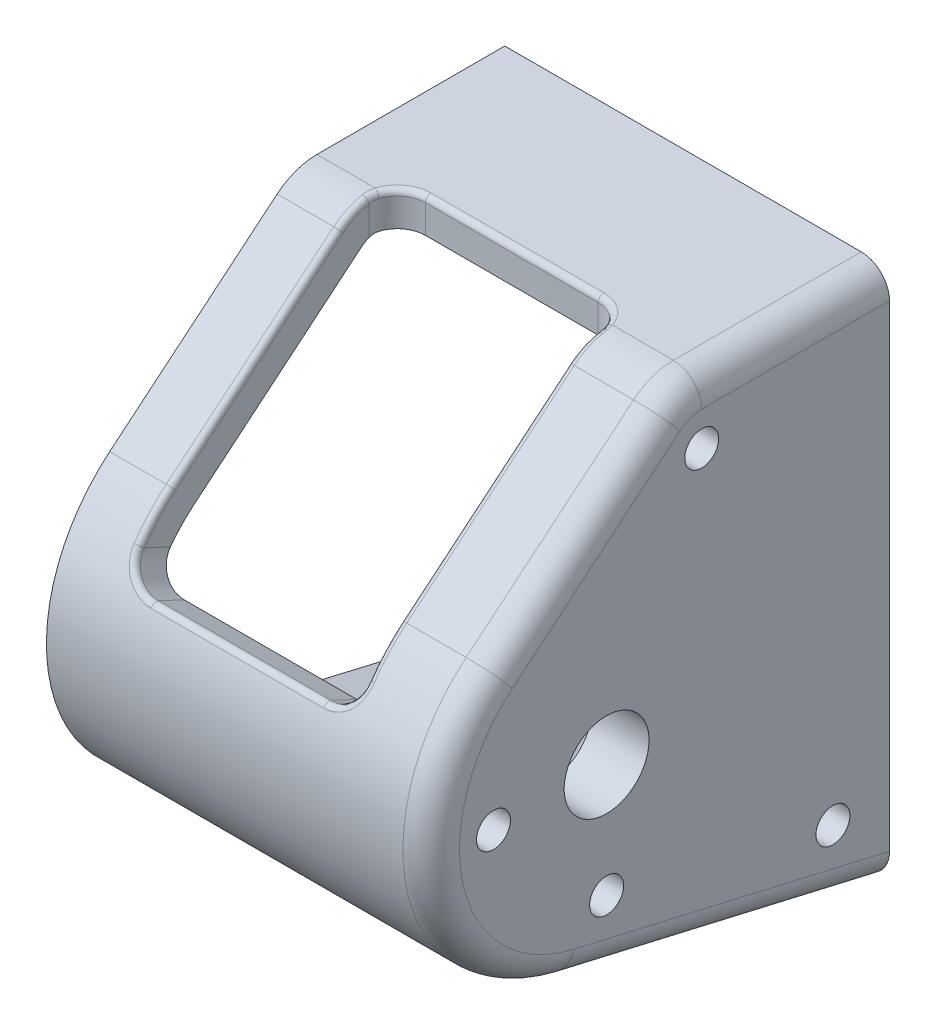
from build123d import *

# Parameters (mm, degrees)
BOSS_EXTRUDE1_DEPTH = 100
CUT_EXTRUDE1_DEPTH  = 126.95237195067031
FILLET1_R           = 5
BOSS_EXTRUDE2_START = 40.5
BOSS_EXTRUDE2_DEPTH = 40.5
FILLET2_R           = 11
FILLET3_R           = 5
BOSS_EXTRUDE4_DEPTH = 10
FILLET5_R           = 1
FILLET6_R           = 5
SKETCH8_R           = 7.5
CUT_EXTRUDE2_DEPTH  = 131.85870255202755
SKETCH9_R           = 1.2499999999993074
SKETCH9_R_2         = 1.2499999999993041
SKETCH9_R_3         = 1.2499999999993108
CUT_EXTRUDE3_DEPTH  = 131.85870255202755
SKETCH10_R          = 2.999999999999271
SKETCH10_R_2        = 2.9999999999993827
SKETCH10_R_3        = 2.9999999999993676
SKETCH10_R_4        = 2.9999999999984848
CUT_EXTRUDE4_DEPTH  = 5


with BuildPart() as part:
    # Sketch1 → Boss-Extrude1 (new body)
    with BuildSketch(Plane(origin=(0, 0, 0), x_dir=(1, 0, 0), z_dir=(0, 1, 0))):
        Polygon((-29.000000000000004, -50), (-29.000000000000004, 50), (28.999999999999996, 50.00000000000001), (28.999999999999996, -50), (22.5, -50), (22.49999999999999, 20.000000000000004), (-18.000000000000007, 20.000000000000004), (-18.000000000000007, -50), align=None)
    extrude(amount=BOSS_EXTRUDE1_DEPTH)

    # Sketch5 → Cut-Extrude1 (cut, through all)
    with BuildSketch(Plane(origin=(28.999999999999996, 0, 0), x_dir=(0, 0, -1), z_dir=(1, 0, 0))):
        with BuildLine():
            Line((50.00000000000001, 94), (15.000000000000007, 94))
            Line((15.000000000000007, 94), (-15.988977704079698, 68.21854812358211))
            ThreePointArc((-15.988977704079698, 68.21854812358211), (-24.331609312743236, 43.25780632057522), (-5.709440185764556, 24.660684217398867))
            Line((-5.709440185764556, 24.660684217398867), (44.000000000000014, 12.999999999999998))
            Line((44.000000000000014, 12.999999999999998), (50.00000000000001, 12.999999999999998))
            Line((50.00000000000001, 12.999999999999998), (50.00000000000001, 94))
        make_face()
        with BuildLine():
            Line((12.83046096501491, 100), (-19.82633235305885, 72.8309996732418))
            ThreePointArc((-19.82633235305885, 72.8309996732418), (-30.160384185664846, 41.83402304126666), (-6.988314668956372, 18.797956061093338))
            Line((-6.988314668956372, 18.797956061093338), (44, 6.999999999999997))
            Line((44, 6.999999999999997), (49.99999999999999, 6.999999999999992))
            Line((49.99999999999999, 6.999999999999992), (49.99999999999999, 0))
            Line((49.99999999999999, 0), (-50.00000000000001, 0))
            Line((-50.00000000000001, 0), (-50.00000000000001, 100))
            Line((-50.00000000000001, 100), (12.83046096501491, 100))
        make_face()
    extrude(amount=-CUT_EXTRUDE1_DEPTH, mode=Mode.SUBTRACT)

    # Fillet1
    fillet1_edges = [part.edges().sort_by_distance(p)[0] for p in [
        (-23.500000000000004, 94, -15.000000000000007),
        (25.749999999999993, 94, -15.000000000000007),
    ]]
    fillet(fillet1_edges, radius=FILLET1_R)

    # Sketch6 → Boss-Extrude2 (add)
    with BuildSketch(Plane(origin=(-18.000000000000007, 0, 0), x_dir=(1e-16, 0, -1), z_dir=(1, 0, 1e-16)).offset(BOSS_EXTRUDE2_START)):
        with BuildLine():
            Line((19.999999999999996, 12.553251706878484), (-6.988314668956373, 18.79795606109335))
            ThreePointArc((-6.988314668956373, 18.79795606109335), (-27.865951255157718, 35.417336025463435), (-28.095541398136127, 62.1011661139617))
            Line((-28.095541398136127, 62.1011661139617), (-22.657694675916233, 59.56545654351749))
            ThreePointArc((-22.657694675916233, 59.56545654351749), (-22.489094420401646, 38.08026409887772), (-5.709440185764564, 24.66068421739888))
            Line((-5.709440185764564, 24.66068421739888), (19.999999999999993, 18.62984455611945))
            Line((19.999999999999993, 18.62984455611945), (19.999999999999996, 12.553251706878484))
        make_face()
    extrude(amount=-BOSS_EXTRUDE2_DEPTH)

    # Fillet2
    fillet2_edges = [part.edges().sort_by_distance(p)[0] for p in [
        (25.749999999999993, 100, -12.83046096501491),
        (-23.500000000000004, 100, -12.83046096501491),
    ]]
    fillet(fillet2_edges, radius=FILLET2_R)

    # Fillet3
    fillet3_edges = [part.edges().sort_by_distance(p)[0] for p in [
        (22.49999999999999, 60.8333113287396, 25.376618037026184),
        (-18.00000000000001, 60.8333113287396, 25.37661803702618),
        (22.49999999999999, 97, -20.000000000000004),
        (-18.000000000000007, 97, -20.000000000000004),
    ]]
    fillet(fillet3_edges, radius=FILLET3_R)

    # Sketch7 → Boss-Extrude4 (add)
    with BuildSketch(Plane(origin=(28.999999999999996, 0, 0), x_dir=(0, 0, -1), z_dir=(1, 0, 0))):
        with BuildLine():
            Line((50.00000000000001, 100), (16.807949195820918, 100))
            ThreePointArc((16.807949195820918, 100), (13.067479500591284, 99.34450996708247), (9.772799006025844, 97.45616117437613))
            Line((9.772799006025844, 97.45616117437613), (-19.82633235305885, 72.8309996732418))
            ThreePointArc((-19.82633235305885, 72.8309996732418), (-30.160384185664846, 41.83402304126666), (-6.9883146689563755, 18.797956061093355))
            Line((-6.9883146689563755, 18.797956061093355), (44, 6.999999999999997))
            Line((44, 6.999999999999997), (49.99999999999999, 6.999999999999992))
            Line((49.99999999999999, 6.999999999999992), (50.00000000000001, 100))
        make_face()
    extrude(amount=BOSS_EXTRUDE4_DEPTH)

    # Fillet5
    fillet5_edges = [part.edges().sort_by_distance(p)[0] for p in [
        (22.49999999999999, 99.00083975111619, -12.227206431541916),
        (-18.000000000000007, 85.14358042380897, 5.026766673516516),
        (22.499999999999993, 69.84794587448418, 22.942605623916762),
        (2.2499999999999893, 62.10116611396171, 28.095541398136127),
        (-18.000000000000007, 99.00083975111619, -12.227206431541916),
        (2.2499999999999893, 100, -20.000000000000004),
        (21.042619780265184, 63.42008867833863, 27.44195770208064),
        (-16.542619780265202, 63.42008867833864, 27.441957702080636),
        (20.324911858881205, 100, -19.12551487569155),
        (22.415270684599754, 99.96382489332538, -15.916577372895661),
        (-17.91527069193968, 99.96382489235059, -15.916577374222168),
        (-15.824911858881226, 100, -19.125514875691554),
        (-18.000000000000004, 69.84794587448418, 22.942605623916755),
        (22.49999999999999, 85.14358042380897, 5.026766673516505),
    ]]
    fillet(fillet5_edges, radius=FILLET5_R)

    # Fillet6
    fillet6_edges = [part.edges().sort_by_distance(p)[0] for p in [
        (39, 12.898978030546676, -18.50584266552181),
        (39, 41.834023041266654, 30.16038418566485),
        (39, 85.14358042380897, 5.026766673516503),
        (39, 99.34450996708247, -13.067479500591286),
        (39, 100, -33.40397459791046),
    ]]
    fillet(fillet6_edges, radius=FILLET6_R)

    # Sketch8 → Cut-Extrude2 (cut, through all)
    with BuildSketch(Plane(origin=(39, 0, 0), x_dir=(0, 0, -1), z_dir=(1, 0, 0))):
        with Locations((-6.94e-15, 49)):
            Circle(SKETCH8_R)
    extrude(amount=-CUT_EXTRUDE2_DEPTH, mode=Mode.SUBTRACT)

    # Sketch9 → Cut-Extrude3 (cut, through all)
    with BuildSketch(Plane(origin=(39, 0, 0), x_dir=(0, 0, -1), z_dir=(1, 0, 0))):
        with Locations((40.00000000000071, 19.744580488536943)):
            Circle(SKETCH9_R)
        with Locations((6.9389e-13, 29.000000000001137)):
            Circle(SKETCH9_R_2)
        with Locations((-19.999999999998934, 49.000000000000405)):
            Circle(SKETCH9_R_2)
        with Locations((16.807949195821617, 89.00000000000007)):
            Circle(SKETCH9_R_3)
    extrude(amount=-CUT_EXTRUDE3_DEPTH, mode=Mode.SUBTRACT)

    # Sketch10 → Cut-Extrude4 (cut)
    with BuildSketch(Plane(origin=(39, 0, 0), x_dir=(0, 0, -1), z_dir=(1, 0, 0))):
        with Locations((16.807949195821624, 89.00000000000007)):
            Circle(SKETCH10_R)
        with Locations((-19.999999999998906, 49.000000000000405)):
            Circle(SKETCH10_R_2)
        with Locations((-1.388e-14, 29.000000000001066)):
            Circle(SKETCH10_R_3)
        with Locations((40.000000000000725, 19.744580488536943)):
            Circle(SKETCH10_R_4)
    extrude(amount=-CUT_EXTRUDE4_DEPTH, mode=Mode.SUBTRACT)


solid = part.part
